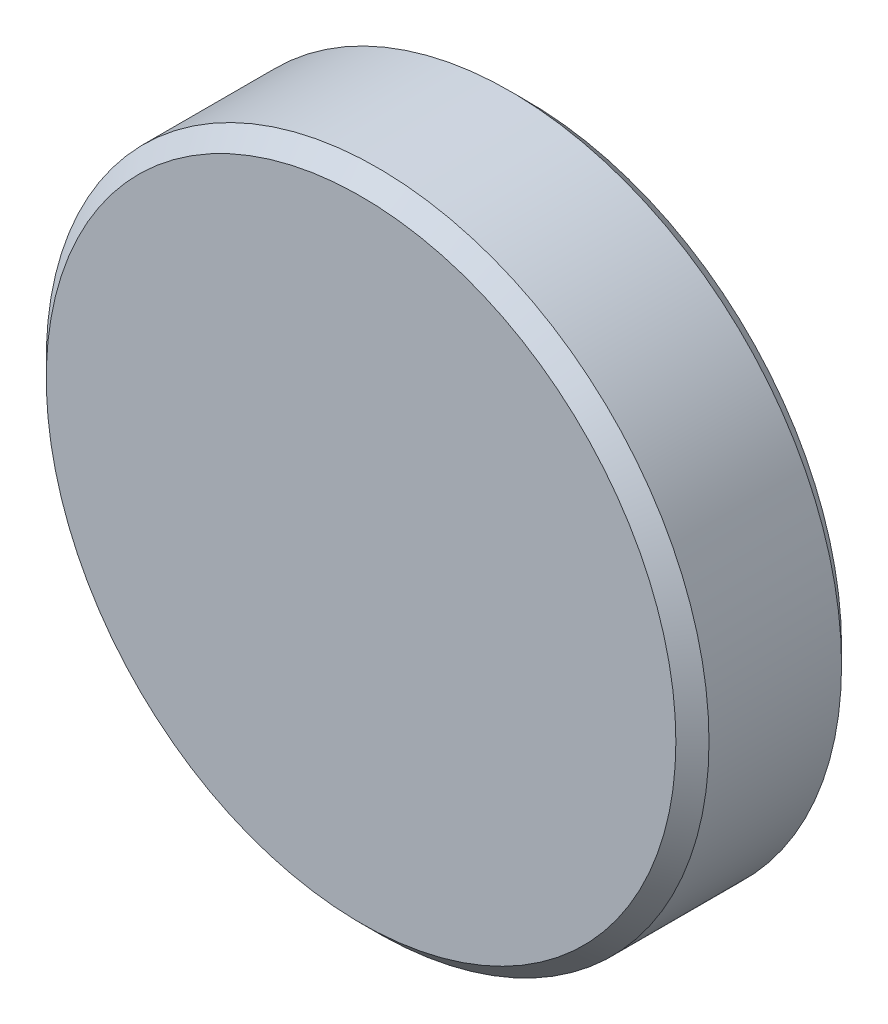
from build123d import *

# Parameters (mm, degrees)
SKETCH_1_R      = 4
EXTRUDE_1_DEPTH = 2
CHAMFER_1_SIZE  = 0.2


with BuildPart() as part:
    # 草图1 → 拉伸1 (new body)
    with BuildSketch(Plane.XY):
        Circle(SKETCH_1_R)
    extrude(amount=EXTRUDE_1_DEPTH)

    # 倒角1
    chamfer_1_edges = [part.edges().sort_by_distance(p)[0] for p in [
        (-4, 0, 0),
        (-4, 0, 2),
    ]]
    chamfer(chamfer_1_edges, length=CHAMFER_1_SIZE)


solid = part.part
